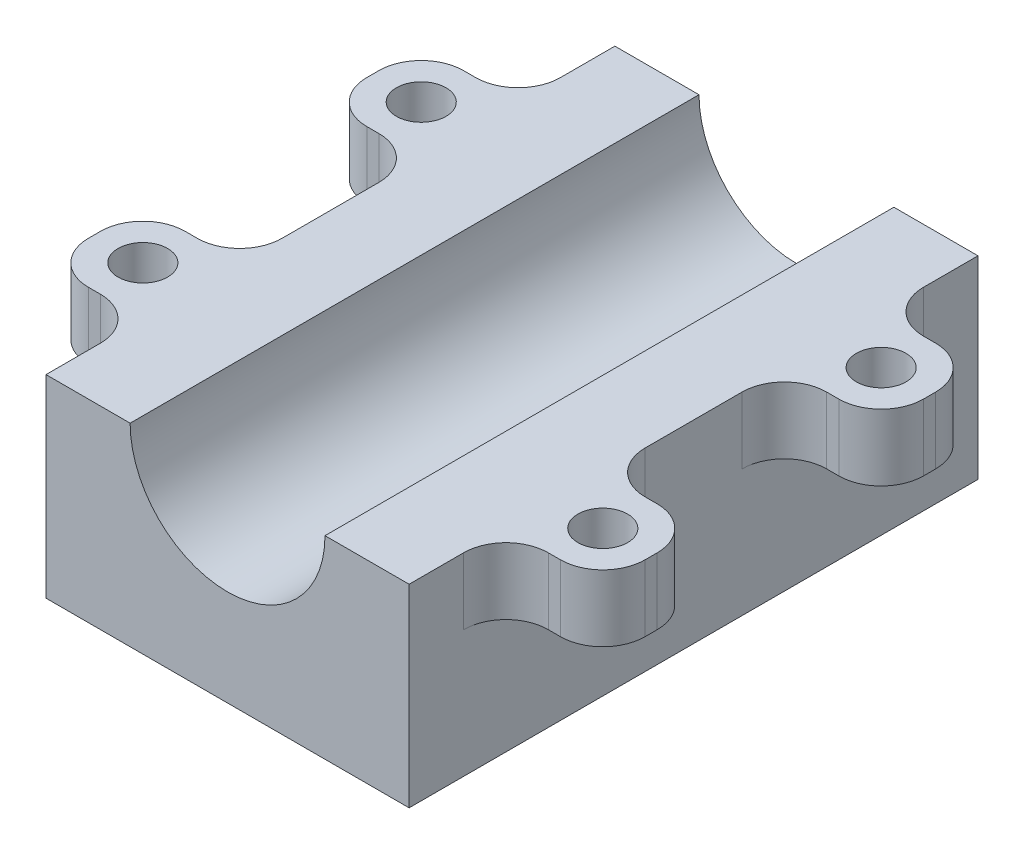
from build123d import *

# Parameters (mm, degrees)
SKETCH1_W               = 30
SKETCH1_H               = 32
SKETCH1_R               = 8.05
BOSS_EXTRUDE1_DEPTH     = 47
CUT_EXTRUDE1_DEPTH      = 52.86520992
CUT_EXTRUDE1_DEPTH_BACK = 52.86520992
SKETCH3_W               = 30
SKETCH3_H               = 16
SKETCH4_W               = 8
SKETCH4_H               = 8
SKETCH4_R               = 2.05
BOSS_EXTRUDE2_DEPTH     = 5.5
FILLET1_R               = 3.5


with BuildPart() as part:
    # Sketch1 → Boss-Extrude1 (new body)
    with BuildSketch(Plane.XY):
        Rectangle(SKETCH1_W, SKETCH1_H)
        Circle(SKETCH1_R, mode=Mode.SUBTRACT)
    extrude(amount=BOSS_EXTRUDE1_DEPTH)

    # Sketch3 → Cut-Extrude1 (cut, two sides: drawn at the far end of the back side and taken through both)
    with BuildSketch(Plane.XY.offset(-CUT_EXTRUDE1_DEPTH_BACK)):
        with Locations((0, 8)):
            Rectangle(SKETCH3_W, SKETCH3_H)
    extrude(amount=CUT_EXTRUDE1_DEPTH + CUT_EXTRUDE1_DEPTH_BACK, mode=Mode.SUBTRACT)

    # Sketch4 → Boss-Extrude2 (add)
    # profile 1 of 4: a face of its own
    with BuildSketch(Plane(origin=(0, 0, 0), x_dir=(1, 0, 0), z_dir=(0, 1, 0))):
        with Locations((19, -12)):
            Rectangle(SKETCH4_W, SKETCH4_H)
        with Locations(Location((19, -12, 0), (0, 0, 270))):
            Circle(SKETCH4_R, mode=Mode.SUBTRACT)
    # profile 2 of 4: a face of its own
    with BuildSketch(Plane(origin=(0, 0, 0), x_dir=(1, 0, 0), z_dir=(0, 1, 0))):
        with Locations((-19, -35)):
            Rectangle(SKETCH4_W, SKETCH4_H)
        with Locations(Location((-19, -35, 0), (0, 0, 270))):
            Circle(SKETCH4_R, mode=Mode.SUBTRACT)
    # profile 3 of 4: a face of its own
    with BuildSketch(Plane(origin=(0, 0, 0), x_dir=(1, 0, 0), z_dir=(0, 1, 0))):
        with Locations((19, -35)):
            Rectangle(SKETCH4_W, SKETCH4_H)
        with Locations(Location((19, -35, 0), (0, 0, 90))):
            Circle(SKETCH4_R, mode=Mode.SUBTRACT)
    # profile 4 of 4: a face of its own
    with BuildSketch(Plane(origin=(0, 0, 0), x_dir=(1, 0, 0), z_dir=(0, 1, 0))):
        with Locations((-19, -12)):
            Rectangle(SKETCH4_W, SKETCH4_H)
        with Locations(Location((-19, -12, 0), (0, 0, 90))):
            Circle(SKETCH4_R, mode=Mode.SUBTRACT)
    extrude(amount=-BOSS_EXTRUDE2_DEPTH)

    # Fillet1
    fillet1_edges = [part.edges().sort_by_distance(p)[0] for p in [
        (-23, -2.75, 8),
        (-15, -2.75, 8),
        (-15, -2.75, 16),
        (-23, -2.75, 16),
        (23, -2.75, 39),
        (15, -2.75, 39),
        (15, -2.75, 31),
        (23, -2.75, 31),
        (-15, -2.75, 31),
        (-15, -2.75, 39),
        (-23, -2.75, 39),
        (-23, -2.75, 31),
        (15, -2.75, 16),
        (15, -2.75, 8),
        (23, -2.75, 8),
        (23, -2.75, 16),
    ]]
    fillet(fillet1_edges, radius=FILLET1_R)


solid = part.part
